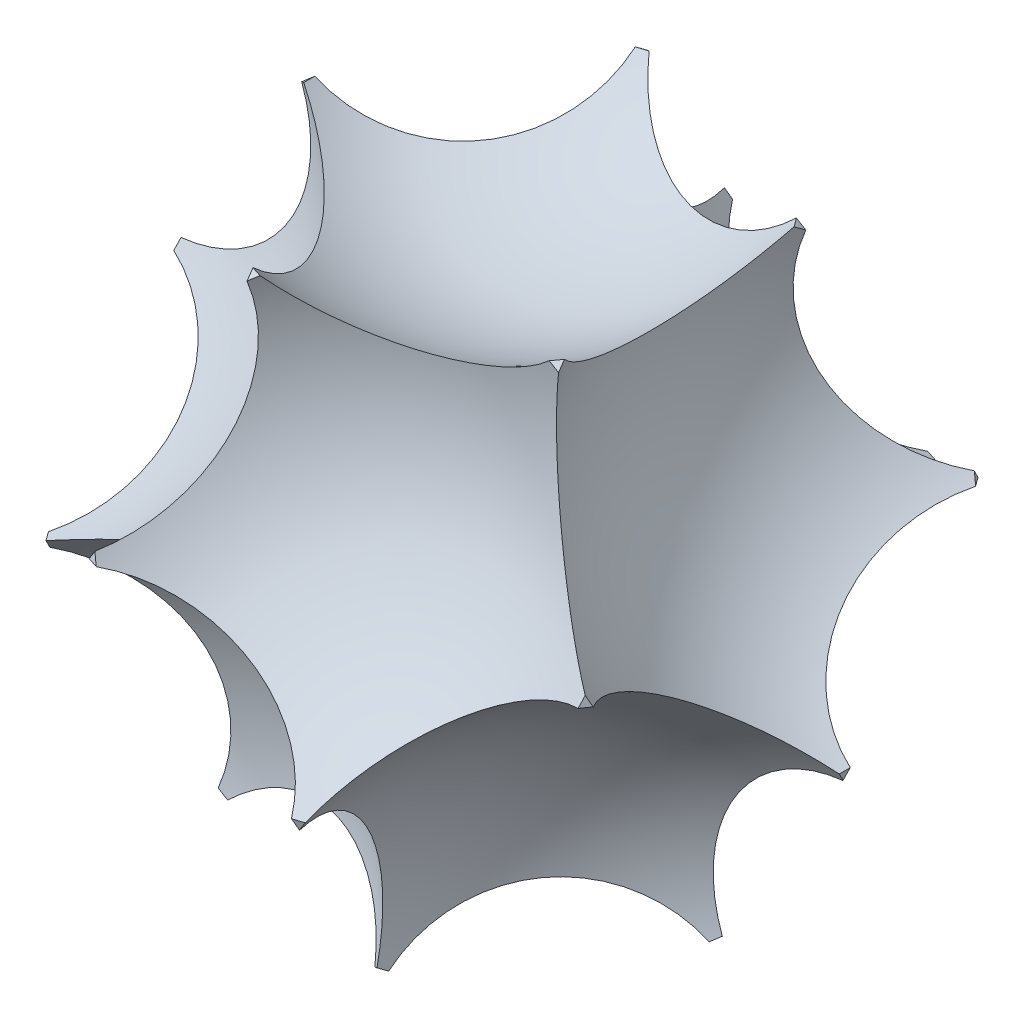
from build123d import *

# Parameters (mm, degrees)
CIRPATTERN1_COUNT = 2
CIRPATTERN1_ANGLE = 116.565051177


with BuildPart() as part:
    # Sketch1 → Revolve1 (revolve)
    with BuildSketch(Plane(origin=(0, 0, 0), x_dir=(1, 0, 0), z_dir=(0, 1, 0))):
        with BuildLine():
            Line((0, -62.5), (0, 62.5))
            ThreePointArc((0, 62.5), (62.5, 0), (0, -62.5))
        make_face()
    revolve(axis=Axis((0, 0, 62.5), (0, 0, -1)))

    # Sketch2 → Cut-Revolve1 (revolve, cut)
    with BuildSketch(Plane.XY):
        with BuildLine():
            Line((0, 142.264715974), (0, 34.784727212))
            ThreePointArc((0, 34.784727212), (-53.739994381, 88.524721593), (0, 142.264715974))
        make_face()
    cut_revolve1 = revolve(axis=Axis((0, 142.264715974, 0), (0, -1, 0)), mode=Mode.SUBTRACT)

    # Mirror1: Cut-Revolve1 across plane
    add(cut_revolve1.mirror(Plane.ZX), mode=Mode.SUBTRACT)

    # CirPattern1: Cut-Revolve1 ×2 about axis
    cirpattern1_axis = Axis((0, 0, -110), (0, 0, 1))
    for i in range(1, CIRPATTERN1_COUNT):
        add(cut_revolve1.rotate(cirpattern1_axis, i * CIRPATTERN1_ANGLE / (CIRPATTERN1_COUNT - 1)), mode=Mode.SUBTRACT)

    # CirPattern1 copy 1 sketch → CirPattern1 copy 1 (revolve, cut)
    with BuildSketch(Plane(origin=(0, 0, 0), x_dir=(-0.44721359549996187, 0.8944271909999139, 0), z_dir=(0, 0, 1))):
        with BuildLine():
            Line((0, -142.264715974), (0, -34.784727212))
            ThreePointArc((0, -34.784727212), (-53.739994381, -88.524721593), (0, -142.264715974))
        make_face()
    revolve(axis=Axis((127.245430287, 63.622715144, 0), (0.894427190999914, 0.4472135954999616, 0)), mode=Mode.SUBTRACT)

    # CirPattern2 copy 1 sketch → CirPattern2 copy 1 (revolve, cut)
    with BuildSketch(Plane(origin=(0, 0, 0), x_dir=(-0.13819660112501175, 0.8944271909999139, -0.42532540417602366), z_dir=(-0.9510565162951535, 0, 0.30901699437494745))):
        with BuildLine():
            Line((0, 142.264715974), (0, 34.784727212))
            ThreePointArc((0, 34.784727212), (-53.739994381, 88.524721593), (0, 142.264715974))
        make_face()
    revolve(axis=Axis((-39.321000415, -63.622715144, -121.017595643), (0.2763932022500204, 0.44721359549996215, 0.8506508083520379)), mode=Mode.SUBTRACT)

    # CirPattern2 copy 2 sketch → CirPattern2 copy 2 (revolve, cut)
    with BuildSketch(Plane(origin=(0, 0, 0), x_dir=(0.36180339887499263, 0.8944271909999139, -0.2628655560595692), z_dir=(-0.5877852522924732, 0, -0.8090169943749473))):
        with BuildLine():
            Line((0, 142.264715974), (0, 34.784727212))
            ThreePointArc((0, 34.784727212), (-53.739994381, 88.524721593), (0, 142.264715974))
        make_face()
    revolve(axis=Axis((102.943715559, -63.622715144, -74.792987344), (-0.7236067977499772, 0.44721359549996215, 0.5257311121191324)), mode=Mode.SUBTRACT)

    # CirPattern2 copy 3 sketch → CirPattern2 copy 3 (revolve, cut)
    with BuildSketch(Plane(origin=(0, 0, 0), x_dir=(0.36180339887499274, 0.8944271909999137, 0.26286555605956907), z_dir=(0.587785252292473, 0, -0.8090169943749476))):
        with BuildLine():
            Line((0, 142.264715974), (0, 34.784727212))
            ThreePointArc((0, 34.784727212), (-53.739994381, 88.524721593), (0, 142.264715974))
        make_face()
    revolve(axis=Axis((102.943715559, -63.622715144, 74.792987344), (-0.7236067977499774, 0.4472135954999621, -0.5257311121191323)), mode=Mode.SUBTRACT)

    # CirPattern2 copy 4 sketch → CirPattern2 copy 4 (revolve, cut)
    with BuildSketch(Plane(origin=(0, 0, 0), x_dir=(-0.13819660112501164, 0.8944271909999139, 0.4253254041760237), z_dir=(0.9510565162951536, 0, 0.30901699437494723))):
        with BuildLine():
            Line((0, 142.264715974), (0, 34.784727212))
            ThreePointArc((0, 34.784727212), (-53.739994381, 88.524721593), (0, 142.264715974))
        make_face()
    revolve(axis=Axis((-39.321000415, -63.622715144, 121.017595643), (0.2763932022500202, 0.44721359549996215, -0.850650808352038)), mode=Mode.SUBTRACT)

    # CirPattern2 copy 5 sketch → CirPattern2 copy 5 (revolve, cut)
    with BuildSketch(Plane(origin=(0, 0, 0), x_dir=(-0.13819660112501175, 0.8944271909999139, -0.42532540417602366), z_dir=(-0.9510565162951535, 0, 0.30901699437494745))):
        with BuildLine():
            Line((0, -142.264715974), (0, -34.784727212))
            ThreePointArc((0, -34.784727212), (-53.739994381, -88.524721593), (0, -142.264715974))
        make_face()
    revolve(axis=Axis((39.321000415, 63.622715144, 121.017595643), (0.2763932022500205, 0.4472135954999616, 0.8506508083520381)), mode=Mode.SUBTRACT)

    # CirPattern2 copy 6 sketch → CirPattern2 copy 6 (revolve, cut)
    with BuildSketch(Plane(origin=(0, 0, 0), x_dir=(0.36180339887499263, 0.8944271909999139, -0.2628655560595692), z_dir=(-0.5877852522924732, 0, -0.8090169943749473))):
        with BuildLine():
            Line((0, -142.264715974), (0, -34.784727212))
            ThreePointArc((0, -34.784727212), (-53.739994381, -88.524721593), (0, -142.264715974))
        make_face()
    revolve(axis=Axis((-102.943715559, 63.622715144, 74.792987344), (-0.7236067977499774, 0.4472135954999616, 0.5257311121191326)), mode=Mode.SUBTRACT)

    # CirPattern2 copy 7 sketch → CirPattern2 copy 7 (revolve, cut)
    with BuildSketch(Plane(origin=(0, 0, 0), x_dir=(0.36180339887499274, 0.8944271909999137, 0.26286555605956907), z_dir=(0.587785252292473, 0, -0.8090169943749476))):
        with BuildLine():
            Line((0, -142.264715974), (0, -34.784727212))
            ThreePointArc((0, -34.784727212), (-53.739994381, -88.524721593), (0, -142.264715974))
        make_face()
    revolve(axis=Axis((-102.943715559, 63.622715144, -74.792987344), (-0.7236067977499776, 0.44721359549996154, -0.5257311121191325)), mode=Mode.SUBTRACT)

    # CirPattern2 copy 8 sketch → CirPattern2 copy 8 (revolve, cut)
    with BuildSketch(Plane(origin=(0, 0, 0), x_dir=(-0.13819660112501164, 0.8944271909999139, 0.4253254041760237), z_dir=(0.9510565162951536, 0, 0.30901699437494723))):
        with BuildLine():
            Line((0, -142.264715974), (0, -34.784727212))
            ThreePointArc((0, -34.784727212), (-53.739994381, -88.524721593), (0, -142.264715974))
        make_face()
    revolve(axis=Axis((39.321000415, 63.622715144, -121.017595643), (0.2763932022500203, 0.4472135954999616, -0.8506508083520382)), mode=Mode.SUBTRACT)

    # CirPattern2 copy 9 sketch → CirPattern2 copy 9 (revolve, cut)
    with BuildSketch(Plane(origin=(0, 0, 0), x_dir=(0.30901699437494745, 0, 0.9510565162951535), z_dir=(-0.9510565162951535, 0, 0.30901699437494745))):
        with BuildLine():
            Line((0, 142.264715974), (0, 34.784727212))
            ThreePointArc((0, 34.784727212), (-53.739994381, 88.524721593), (0, 142.264715974))
        make_face()
    revolve(axis=Axis((0, 142.264715974, 0), (0, -1, 0)), mode=Mode.SUBTRACT)

    # CirPattern2 copy 10 sketch → CirPattern2 copy 10 (revolve, cut)
    with BuildSketch(Plane(origin=(0, 0, 0), x_dir=(-0.8090169943749473, 0, 0.5877852522924732), z_dir=(-0.5877852522924732, 0, -0.8090169943749473))):
        with BuildLine():
            Line((0, 142.264715974), (0, 34.784727212))
            ThreePointArc((0, 34.784727212), (-53.739994381, 88.524721593), (0, 142.264715974))
        make_face()
    revolve(axis=Axis((0, 142.264715974, 0), (0, -1, 0)), mode=Mode.SUBTRACT)

    # CirPattern2 copy 11 sketch → CirPattern2 copy 11 (revolve, cut)
    with BuildSketch(Plane(origin=(0, 0, 0), x_dir=(-0.8090169943749476, 0, -0.587785252292473), z_dir=(0.587785252292473, 0, -0.8090169943749476))):
        with BuildLine():
            Line((0, 142.264715974), (0, 34.784727212))
            ThreePointArc((0, 34.784727212), (-53.739994381, 88.524721593), (0, 142.264715974))
        make_face()
    revolve(axis=Axis((0, 142.264715974, 0), (0, -1, 0)), mode=Mode.SUBTRACT)

    # CirPattern2 copy 12 sketch → CirPattern2 copy 12 (revolve, cut)
    with BuildSketch(Plane(origin=(0, 0, 0), x_dir=(0.30901699437494723, 0, -0.9510565162951536), z_dir=(0.9510565162951536, 0, 0.30901699437494723))):
        with BuildLine():
            Line((0, 142.264715974), (0, 34.784727212))
            ThreePointArc((0, 34.784727212), (-53.739994381, 88.524721593), (0, 142.264715974))
        make_face()
    revolve(axis=Axis((0, 142.264715974, 0), (0, -1, 0)), mode=Mode.SUBTRACT)


solid = part.part
